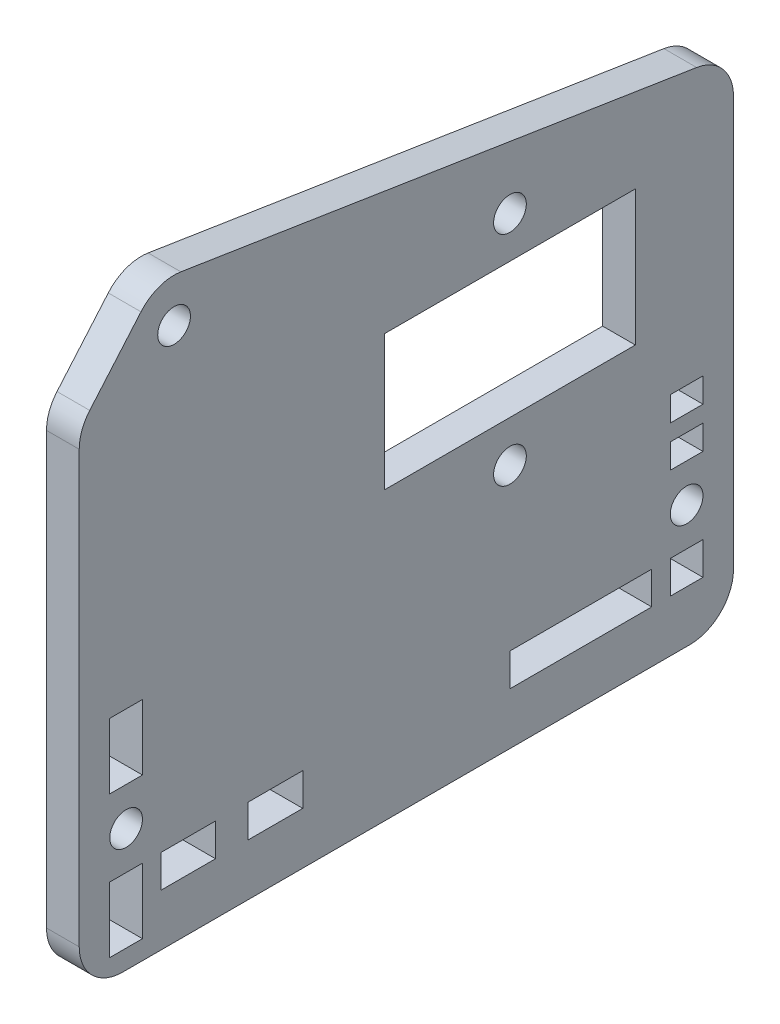
from build123d import *

# Parameters (mm, degrees)
RESSALTO_EXTRUS_O1_DEPTH   = 3
PERFIL_CORTE_W             = 23
PERFIL_CORTE_H             = 12.4
CORTE_PRINCIPAL_DEPTH      = 55.998187902
FURO_DE_DI_METRO_3_0_3_1_D = 3
ESBO_O6_W                  = 3
ESBO_O6_H                  = 6
ESBO_O6_H_2                = 2.25
ESBO_O6_H_3                = 3
CORTE_EXTRUS_O1_DEPTH      = 81.112421009
FURO_DE_DI_METRO_3_0_3_2_D = 3
FURO_DE_DI_METRO_3_0_3_3_D = 3
ESBO_O9_W                  = 5
ESBO_O9_H                  = 3
ESBO_O9_W_2                = 13
CORTE_EXTRUS_O2_DEPTH      = 81.112421009
FILETE1_R                  = 4


with BuildPart() as part:
    # Esboço1 → Ressalto-extrusão1 (new body)
    with BuildSketch(Plane(origin=(0, 0, 0), x_dir=(0, 0, -1), z_dir=(1, 0, 0))):
        with BuildLine():
            Line((0, 0), (60, 0))
            Line((60, 0), (60, 45))
            Line((60, 45), (9.320012162, 52.951655972))
            ThreePointArc((9.320012162, 52.951655972), (7.316640593, 52.753174223), (5.663681972, 51.603991711))
            Line((5.663681972, 51.603991711), (0, 45))
            Line((0, 45), (0, 0))
        make_face()
    extrude(amount=RESSALTO_EXTRUS_O1_DEPTH)

    # Perfil Corte → Corte Principal (cut, through all)
    with BuildSketch(Plane(origin=(0, 41.400449156, -36.080513885), x_dir=(0, 0, 1), z_dir=(-1, 0, 0))):
        with Locations((-3.419486115, -8.900449156)):
            Rectangle(PERFIL_CORTE_W, PERFIL_CORTE_H)
    extrude(amount=-CORTE_PRINCIPAL_DEPTH, mode=Mode.SUBTRACT)

    # Furo de diâmetro Ø3.0 (3)1 (through all)
    with Locations(Plane(origin=(0, -50, -154.479871529), x_dir=(0, 0, 1), z_dir=(-1, 0, 0))):
        with Locations((114.979871529, 92.5), (114.979871529, 72.5)):
            Hole(FURO_DE_DI_METRO_3_0_3_1_D / 2)

    # Esboço6 → Corte-extrusão1 (cut, through all)
    with BuildSketch(Plane(origin=(0, 0, 0), x_dir=(0, 0, -1), z_dir=(1, 0, 0))):
        with Locations((4.3, 17.75)):
            Rectangle(ESBO_O6_W, ESBO_O6_H)
        with Locations((4.3, 4.75)):
            Rectangle(ESBO_O6_W, ESBO_O6_H)
        with Locations((55.7, 19.625)):
            Rectangle(ESBO_O6_W, ESBO_O6_H_2)
        with Locations((55.7, 15.875)):
            Rectangle(ESBO_O6_W, ESBO_O6_H_2)
        with Locations((55.7, 6.25)):
            Rectangle(ESBO_O6_W, ESBO_O6_H_3)
    extrude(amount=CORTE_EXTRUS_O1_DEPTH, mode=Mode.SUBTRACT)

    # Furo de diâmetro Ø3.0 (3)2 (through all)
    with Locations(Plane(origin=(3, 0, 0), x_dir=(0, 0, -1), z_dir=(1, 0, 0))):
        with Locations((4.3, 11.25), (55.7, 11.25)):
            Hole(FURO_DE_DI_METRO_3_0_3_2_D / 2)

    # Furo de diâmetro Ø3.0 (3)3 (through all)
    with Locations(Plane.ZY):
        with Locations((-8.7, 49)):
            Hole(FURO_DE_DI_METRO_3_0_3_3_D / 2)

    # Esboço9 → Corte-extrusão2 (cut, through all)
    with BuildSketch(Plane(origin=(0, 0, 0), x_dir=(0, 0, -1), z_dir=(1, 0, 0))):
        with Locations((10, 6.25)):
            Rectangle(ESBO_O9_W, ESBO_O9_H)
        with Locations((18, 6.25)):
            Rectangle(ESBO_O9_W, ESBO_O9_H)
        with Locations((46, 6.25)):
            Rectangle(ESBO_O9_W_2, ESBO_O9_H)
    extrude(amount=CORTE_EXTRUS_O2_DEPTH, mode=Mode.SUBTRACT)

    # Filete1
    filete1_edges = [part.edges().sort_by_distance(p)[0] for p in [
        (1.5, 45, 0),
        (1.5, 45, -60),
        (1.5, 0, -60),
        (1.5, 0, 0),
    ]]
    fillet(filete1_edges, radius=FILETE1_R)


solid = part.part
